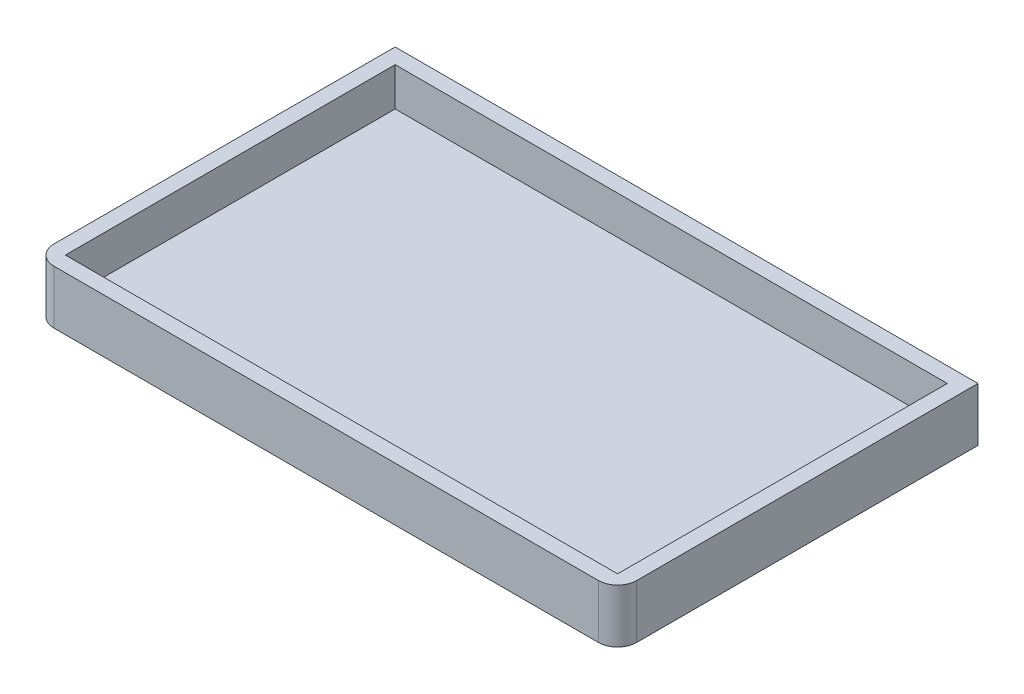
from build123d import *

# Parameters (mm, degrees)
SKETCH2_W           = 50
SKETCH2_H           = 41
BOSS_EXTRUDE1_DEPTH = 4
SKETCH4_W           = 152
SKETCH4_H           = 94
BOSS_EXTRUDE2_DEPTH = 14
CUT_EXTRUDE1_DEPTH  = 10
FILLET1_R           = 5
SKETCH5_W           = 4
SKETCH5_H           = 41
BOSS_EXTRUDE3_DEPTH = 80
CUT_EXTRUDE2_DEPTH  = 4
SKETCH7_R           = 2
CUT_EXTRUDE3_DEPTH  = 4
CHAMFER1_SIZE       = 1
FILLET2_R           = 5


with BuildPart() as part:
    # Sketch2 → Boss-Extrude1 (new body)
    with BuildSketch(Plane.XY):
        with Locations((25, 20.5)):
            Rectangle(SKETCH2_W, SKETCH2_H)
    extrude(amount=BOSS_EXTRUDE1_DEPTH)

    # Sketch4 → Boss-Extrude2 (add)
    with BuildSketch(Plane(origin=(0, 41, 0), x_dir=(1, 0, 0), z_dir=(0, 1, 0))):
        with Locations((25, -47)):
            Rectangle(SKETCH4_W, SKETCH4_H)
    extrude(amount=BOSS_EXTRUDE2_DEPTH)

    # 3DSketch1 → Cut-Extrude1 (cut)
    with BuildSketch(Plane(origin=(97, 55, 90), x_dir=(-0.8585432690668222, 0, -0.512741119026019), z_dir=(0, -1, 0))):
        Polygon((0, 0), (44.095736236, 73.83472114), (167.725966982, 0), (123.630230746, -73.83472114), align=None)
    extrude(amount=CUT_EXTRUDE1_DEPTH, mode=Mode.SUBTRACT)

    # Fillet1
    fillet1_edges = [part.edges().sort_by_distance(p)[0] for p in [
        (-51, 48, 94),
        (101, 48, 94),
    ]]
    fillet(fillet1_edges, radius=FILLET1_R)

    # Sketch5 → Boss-Extrude3 (add)
    with BuildSketch(Plane.XY.offset(4)):
        with Locations((25, 20.5)):
            Rectangle(SKETCH5_W, SKETCH5_H)
    extrude(amount=BOSS_EXTRUDE3_DEPTH)

    # Sketch6 → Cut-Extrude2 (cut)
    with BuildSketch(Plane(origin=(27, 0, 0), x_dir=(0, 0, -1), z_dir=(1, 0, 0))):
        Polygon((-4, 0), (-84, 0), (-84, 41), (-68, 41), (-4, 16), align=None)
    extrude(amount=-CUT_EXTRUDE2_DEPTH, mode=Mode.SUBTRACT)

    # Sketch7 → Cut-Extrude3 (cut)
    with BuildSketch(Plane.XY.offset(4)):
        with Locations((12.5, 8)):
            Circle(SKETCH7_R)
        with Locations((37.5, 8)):
            Circle(SKETCH7_R)
        with Locations(Location((37.5, 33, 0), (0, 0, 180))):
            Circle(SKETCH7_R)
        with Locations(Location((12.5, 33, 0), (0, 0, 180))):
            Circle(SKETCH7_R)
    extrude(amount=-CUT_EXTRUDE3_DEPTH, mode=Mode.SUBTRACT)

    # Chamfer1
    chamfer1_edges = [part.edges().sort_by_distance(p)[0] for p in [
        (10.5, 8, 4),
        (14.5, 33, 4),
        (39.5, 33, 4),
        (35.5, 8, 4),
    ]]
    chamfer(chamfer1_edges, length=CHAMFER1_SIZE)

    # Fillet2
    fillet2_edges = [part.edges().sort_by_distance(p)[0] for p in [
        (0, 41, 2),
        (50, 41, 2),
    ]]
    fillet(fillet2_edges, radius=FILLET2_R)


solid = part.part
